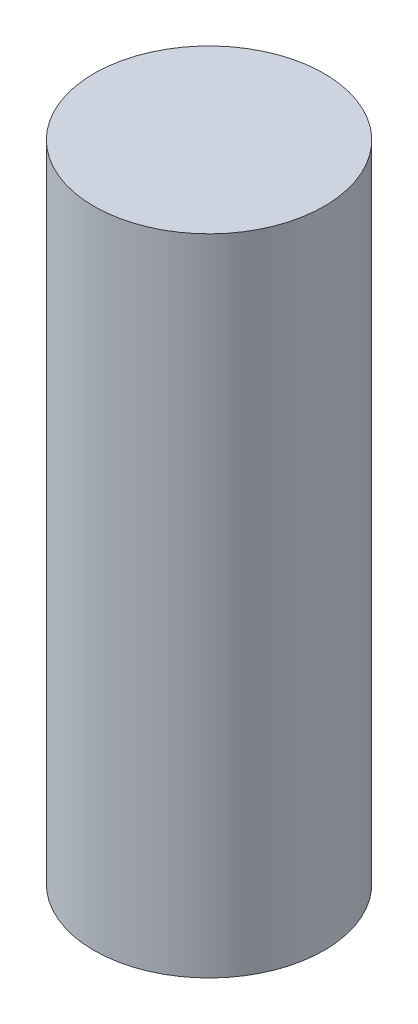
from build123d import *

# Parameters (mm, degrees)
SKETCH2_R           = 12.5
BOSS_EXTRUDE1_DEPTH = 70


with BuildPart() as part:
    # Sketch2 → Boss-Extrude1 (new body)
    with BuildSketch(Plane(origin=(0, 0, 0), x_dir=(1, 0, 0), z_dir=(0, 1, 0))):
        with Locations(Location((0, 0, 0), (0, 0, 270))):
            Circle(SKETCH2_R)
    extrude(amount=-BOSS_EXTRUDE1_DEPTH)


solid = part.part
